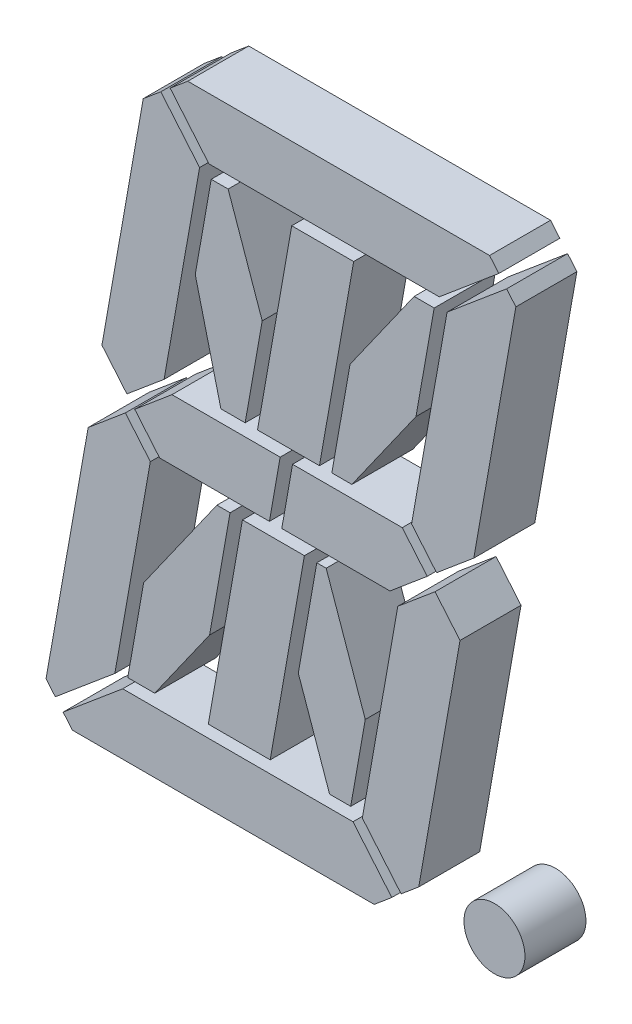
from build123d import *

# Parameters (mm, degrees)
EXTRUDE_1_DEPTH   = 1
EXTRUDE_1_2_DEPTH = 1
EXTRUDE_1_3_DEPTH = 1
EXTRUDE_1_4_DEPTH = 1
EXTRUDE_1_5_DEPTH = 1
EXTRUDE_1_6_DEPTH = 1
EXTRUDE_1_7_DEPTH = 1
EXTRUDE_1_8_DEPTH = 1
EXTRUDE_2_DEPTH   = 1
EXTRUDE_2_2_DEPTH = 1
SKETCH_8_R        = 0.5
EXTRUDE_3_DEPTH   = 1
EXTRUDE_4_DEPTH   = 1
EXTRUDE_4_2_DEPTH = 1
EXTRUDE_4_3_DEPTH = 1
EXTRUDE_4_4_DEPTH = 1


with BuildPart() as part:
    # Эскиз5 → Бобышка-Вытянуть1 (new body)
    with BuildSketch(Plane.XY):
        Polygon((-2.935448186, 0.628557522), (-2.258598217, 4.467164446), (-1.970028174, 4.709303462), (-1.334107302, 3.951442478), (-1.915674873, 0.653208889), (-2.526240846, 0.140883205), align=None)
    extrude(amount=EXTRUDE_1_DEPTH)


with BuildPart() as body_2:
    # Эскиз5 → Extrude 1 2 (new body)
    with BuildSketch(Plane.XY):
        Polygon((-3.161458187, -0.653208889), (-2.550892213, -0.140883205), (-2.141684874, -0.628557522), (-2.723252444, -3.926791111), (-3.699881881, -4.746280512), (-3.851348259, -4.565769912), align=None)
    extrude(amount=EXTRUDE_1_2_DEPTH)


with BuildPart() as body_3:
    # Эскиз5 → Extrude 1 3 (new body)
    with BuildSketch(Plane.XY):
        Polygon((-3.571324359, -4.8994894), (-2.594694922, -4.08), (1.180898414, -4.08), (1.816819285, -4.837860984), (1.528249243, -5.08), (-3.419857982, -5.08), align=None)
    extrude(amount=EXTRUDE_1_3_DEPTH)


with BuildPart() as body_4:
    # Эскиз5 → Extrude 1 4 (new body)
    with BuildSketch(Plane.XY):
        Polygon((1.915674873, -0.653208889), (2.526240846, -0.140883205), (2.935448186, -0.628557522), (2.258598217, -4.467164446), (1.970028174, -4.709303462), (1.334107302, -3.951442478), align=None)
    extrude(amount=EXTRUDE_1_4_DEPTH)


with BuildPart() as body_5:
    # Эскиз5 → Extrude 1 5 (new body)
    with BuildSketch(Plane.XY):
        Polygon((2.141684874, 0.628557522), (2.550892213, 0.140883205), (3.161458187, 0.653208889), (3.851348259, 4.565769912), (3.699881881, 4.746280512), (2.723252444, 3.926791111), align=None)
    extrude(amount=EXTRUDE_1_5_DEPTH)


with BuildPart() as body_6:
    # Эскиз5 → Extrude 1 6 (new body)
    with BuildSketch(Plane.XY):
        Polygon((-1.816819285, 4.837860984), (-1.528249243, 5.08), (3.419857982, 5.08), (3.571324359, 4.8994894), (2.594694922, 4.08), (-1.180898414, 4.08), align=None)
    extrude(amount=EXTRUDE_1_6_DEPTH)


with BuildPart() as body_7:
    # Эскиз5 → Extrude 1 7 (new body)
    with BuildSketch(Plane.XY):
        Polygon((-1.988475985, -0.5), (-0.189706152, -0.5), (-0.013379171, 0.5), (-1.787117351, 0.5), (-2.397683324, -0.012325683), align=None)
    extrude(amount=EXTRUDE_1_7_DEPTH)


with BuildPart() as body_8:
    # Эскиз5 → Extrude 1 8 (new body)
    with BuildSketch(Plane.XY):
        Polygon((0.189706152, 0.5), (1.988475985, 0.5), (2.397683324, 0.012325683), (1.787117351, -0.5), (0.013379171, -0.5), align=None)
    extrude(amount=EXTRUDE_1_8_DEPTH)


with BuildPart() as body_9:
    # Эскиз6 → Бобышка-Вытянуть2 (new body)
    with BuildSketch(Plane.XY):
        Polygon((-0.384284419, 0.7), (0.631142192, 0.7), (1.191861991, 3.88), (0.176435379, 3.88), align=None)
    extrude(amount=EXTRUDE_2_DEPTH)


with BuildPart() as body_10:
    # Эскиз6 → Extrude 2 2 (new body)
    with BuildSketch(Plane.XY):
        Polygon((-0.631142192, -0.7), (-1.191861991, -3.88), (-0.176435379, -3.88), (0.384284419, -0.7), align=None)
    extrude(amount=EXTRUDE_2_2_DEPTH)


with BuildPart() as body_11:
    # Эскиз8 → Бобышка-Вытянуть3 (new body)
    with BuildSketch(Plane.XY):
        with Locations((3.5, -4.58)):
            Circle(SKETCH_8_R)
    extrude(amount=EXTRUDE_3_DEPTH)


with BuildPart() as body_12:
    # Эскиз7 → Бобышка-Вытянуть4 (new body)
    with BuildSketch(Plane.XY):
        Polygon((-2.251347225, -2.40223772), (-2.511916587, -3.88), (-2.070426511, -3.88), (-1.170027732, -2.604417668), (-0.834227515, -0.7), (-1.049784045, -0.7), align=None)
    extrude(amount=EXTRUDE_4_DEPTH)


with BuildPart() as body_13:
    # Эскиз7 → Extrude 4 2 (new body)
    with BuildSketch(Plane.XY):
        Polygon((0.587369742, -0.7), (0.740825314, -0.7), (1.382118658, -2.52740245), (1.143619216, -3.88), (0.796998801, -3.88), (0.284271691, -2.418954467), align=None)
    extrude(amount=EXTRUDE_4_2_DEPTH)


with BuildPart() as body_14:
    # Эскиз7 → Extrude 4 3 (new body)
    with BuildSketch(Plane.XY):
        Polygon((2.183113044, 3.88), (2.511916587, 3.88), (2.213825111, 2.189439235), (1.162470577, 0.7), (0.834227515, 0.7), (1.132505618, 2.391619183), align=None)
    extrude(amount=EXTRUDE_4_3_DEPTH)


with BuildPart() as body_15:
    # Эскиз7 → Extrude 4 4 (new body)
    with BuildSketch(Plane.XY):
        Polygon((-0.984913448, 0.7), (-0.587369742, 0.7), (-0.307494907, 2.28724906), (-0.866441612, 3.88), (-1.143619216, 3.88), (-1.405341875, 2.395697044), align=None)
    extrude(amount=EXTRUDE_4_4_DEPTH)


solid = Compound([part.part, body_2.part, body_3.part, body_4.part, body_5.part, body_6.part, body_7.part, body_8.part, body_9.part, body_10.part, body_11.part, body_12.part, body_13.part, body_14.part, body_15.part])
